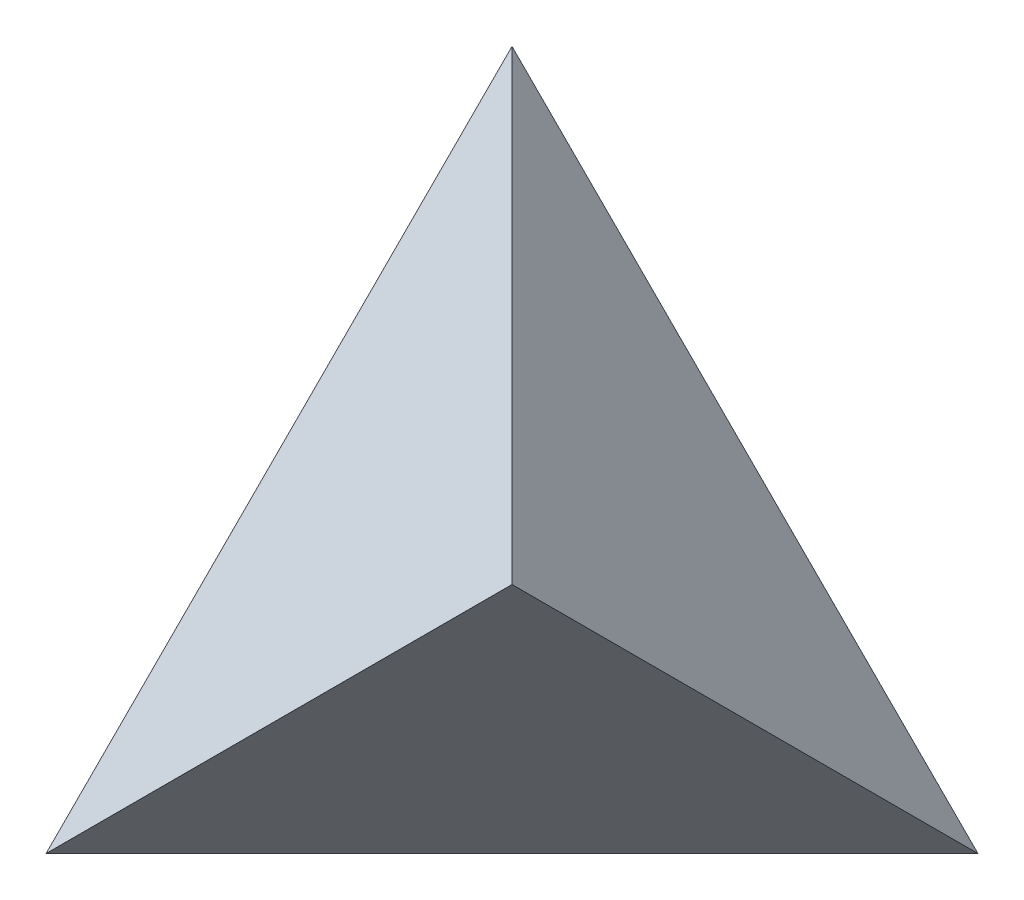
from build123d import *

# Parameters (mm, degrees)
CIRPATTERN2_2_ANGLE   = 180
CIRPATTERN2_2_5_ANGLE = 180


with BuildPart() as body_1:
    # Sketch12 → Surface-Plane4: a flat surface bounded by the sketch
    with BuildSketch(Plane(origin=(-2.357022604, -2.357022604, -2.357022604), x_dir=(0.4082482904638632, 0.4082482904638626, -0.8164965809277261), z_dir=(0.5773502691896264, 0.5773502691896254, 0.5773502691896256)), mode=Mode.PRIVATE) as surface_plane4_1_region:
        Polygon((-11.547005384, 0), (5.773502692, -10), (5.773502692, 10), align=None)
    surface_plane4_1 = surface_plane4_1_region.sketch.faces()[0]
    # CirPattern2: a copy of that surface (a pattern of surface bodies)
    cirpattern2_2 = surface_plane4_1.rotate(Axis((0, 0, 0), (0, 1, 0)), CIRPATTERN2_2_ANGLE)
    # Sketch11 → Surface-Plane3: a flat surface bounded by the sketch
    with BuildSketch(Plane(origin=(2.357022604, 2.357022604, -2.357022604), x_dir=(0.40824829046386335, 0.4082482904638629, 0.8164965809277259), z_dir=(-0.577350269189626, -0.5773502691896255, 0.577350269189626)), mode=Mode.PRIVATE) as surface_plane3_3_region:
        Polygon((-5.773502692, -10), (11.547005384, 0), (-5.773502692, 10), align=None)
    surface_plane3_3 = surface_plane3_3_region.sketch.faces()[0]
    # Sketch11 → Surface-Plane3: a flat surface bounded by the sketch
    with BuildSketch(Plane(origin=(2.357022604, 2.357022604, -2.357022604), x_dir=(0.40824829046386335, 0.4082482904638629, 0.8164965809277259), z_dir=(-0.577350269189626, -0.5773502691896255, 0.577350269189626)), mode=Mode.PRIVATE) as surface_plane3_4_region:
        Polygon((-5.773502692, -10), (11.547005384, 0), (-5.773502692, 10), align=None)
    surface_plane3_4 = surface_plane3_4_region.sketch.faces()[0]
    # CirPattern2 2: a copy of that surface (a pattern of surface bodies)
    cirpattern2_2_5 = surface_plane3_4.rotate(Axis((0, 0, 0), (0, 1, 0)), CIRPATTERN2_2_5_ANGLE)
    # Sketch12 → Surface-Plane4: a flat surface bounded by the sketch
    with BuildSketch(Plane(origin=(-2.357022604, -2.357022604, -2.357022604), x_dir=(0.4082482904638632, 0.4082482904638626, -0.8164965809277261), z_dir=(0.5773502691896264, 0.5773502691896254, 0.5773502691896256)), mode=Mode.PRIVATE) as surface_plane4_6_region:
        Polygon((-11.547005384, 0), (5.773502692, -10), (5.773502692, 10), align=None)
    surface_plane4_6 = surface_plane4_6_region.sketch.faces()[0]
    # Surface-Knit2: the surfaces knitted into a closed skin and filled: a solid
    add(Solid(Shell(Face.sew_faces(cirpattern2_2.faces() + surface_plane3_3.faces() + cirpattern2_2_5.faces() + surface_plane4_6.faces())[0])))


solid = body_1.part
